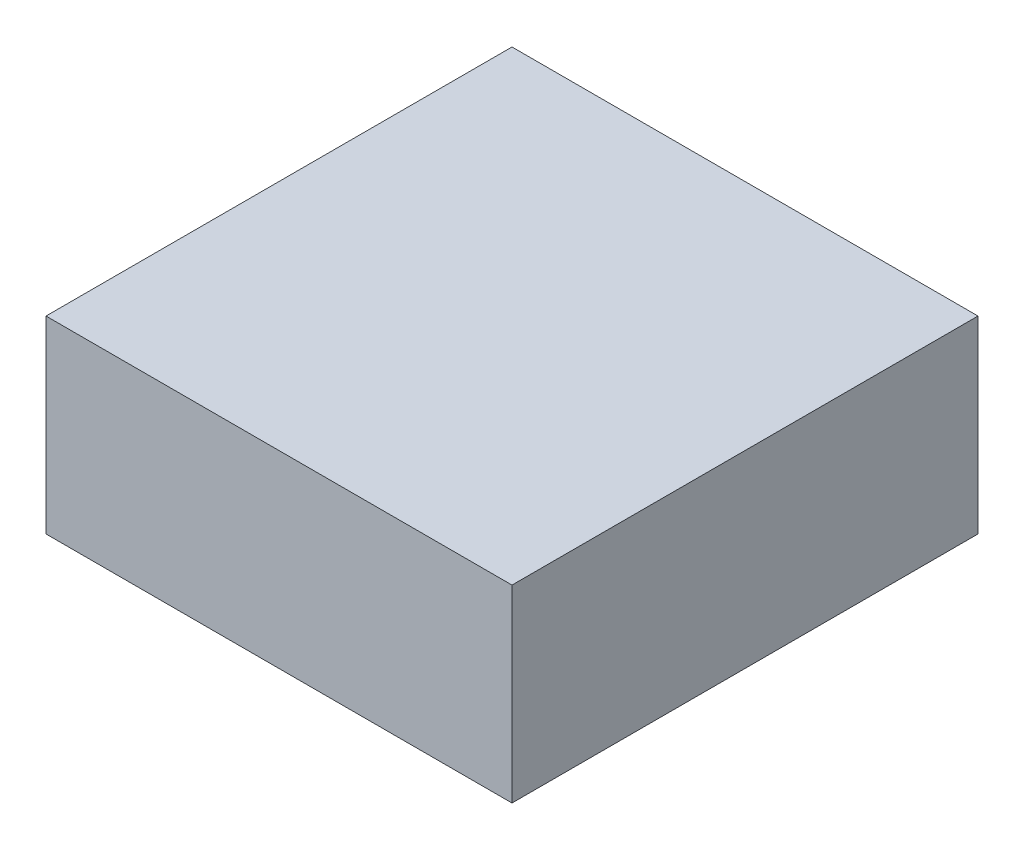
from build123d import *

# Parameters (mm, degrees)
MAINBASESKETCH_W         = 7.9
MAINBASESKETCH_H         = 3.2
MAINBASEEXTRUDE_DEPTH    = 7.9
MAINBASESHELL_T          = -1.2
SKETCH171_W              = 5.5
SKETCH171_H              = 1.191135725
BOSS_EXTRUDE23_DEPTH     = 2
CUT_EXTRUDE58_DEPTH      = 12.83470157
CUT_EXTRUDE58_DEPTH_BACK = 12.83470157


with BuildPart() as part:
    # MainBaseSketch → MainBaseExtrude (new, symmetric)
    with BuildSketch(Plane.XY):
        with Locations((4.631967213, 1.6)):
            Rectangle(MAINBASESKETCH_W, MAINBASESKETCH_H)
    extrude(amount=MAINBASEEXTRUDE_DEPTH, both=True)

    # MainBaseShell
    mainbaseshell_openings = [part.faces().sort_by_distance(p)[0] for p in [
        (4.631967213, 0, 0),
    ]]
    offset(amount=MAINBASESHELL_T, openings=mainbaseshell_openings, kind=Kind.INTERSECTION)

    # Sketch171 → Boss-Extrude23 (add)
    with BuildSketch(Plane(origin=(0, 2, 0), x_dir=(-1, 0, 0), z_dir=(0, -1, 0))):
        with Locations((-4.631967213, -0.595567863)):
            Rectangle(SKETCH171_W, SKETCH171_H)
    extrude(amount=BOSS_EXTRUDE23_DEPTH)

    # Sketch173 → Cut-Extrude58 (cut, two sides: drawn at the far end of the back side and taken through both)
    with BuildSketch(Plane(origin=(0, 2, 0), x_dir=(-1, 0, 0), z_dir=(0, -1, 0)).offset(-CUT_EXTRUDE58_DEPTH_BACK)):
        Polygon((-7.381967213, 0), (-8.581967213, 0), (-8.581967213, 7.9), (-0.681967213, 7.9), (-0.681967213, 0), align=None)
    extrude(amount=CUT_EXTRUDE58_DEPTH + CUT_EXTRUDE58_DEPTH_BACK, mode=Mode.SUBTRACT)


solid = part.part
